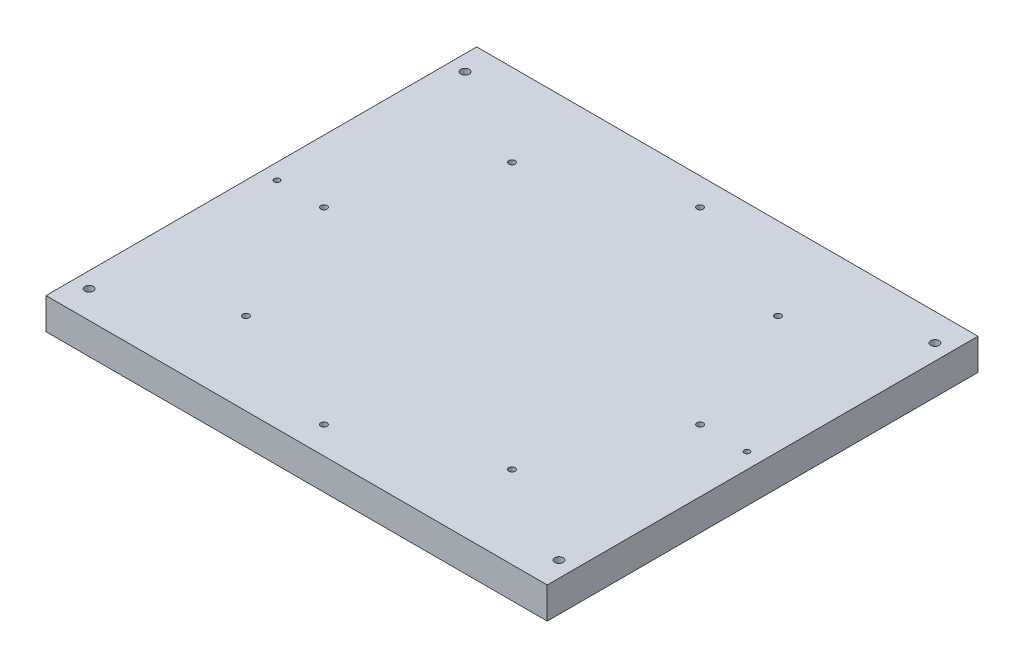
from build123d import *

# Parameters (mm, degrees)
SKETCH1_W                   = 406.4
SKETCH1_H                   = 349.25
BOSS_EXTRUDE1_DEPTH         = 25.4
F_1_4_CLEARANCE_HOLE1_D     = 6.7564
F_1_4_CLEARANCE_HOLE1_DEPTH = 70
F_1_4_CLEARANCE_HOLE1_TIP   = 2.029827343
F_8_CLEARANCE_HOLE1_D       = 4.4958
F_8_CLEARANCE_HOLE1_DEPTH   = 70
F_8_CLEARANCE_HOLE1_TIP     = 1.350674586
F_1_4_20_TAPPED_HOLE1_D     = 5.1054
F_1_4_20_TAPPED_HOLE1_DEPTH = 39.05
F_1_4_20_TAPPED_HOLE1_TIP   = 1.533816902


with BuildPart() as part:
    # Sketch1 → Boss-Extrude1 (new body)
    with BuildSketch(Plane(origin=(0, 0, 0), x_dir=(1, 0, 0), z_dir=(0, 1, 0))):
        with Locations((1.5875, 1.5875)):
            Rectangle(SKETCH1_W, SKETCH1_H)
    extrude(amount=BOSS_EXTRUDE1_DEPTH)

    # 1/4 Clearance Hole1
    with Locations(Plane(origin=(-188.9125, 25.4, -153.9875), x_dir=(0, 0, 1), z_dir=(0, 1, 0))):
        with Locations((0, 0), (0, 381), (304.8, 381), (304.8, 0)):
            Hole(F_1_4_CLEARANCE_HOLE1_D / 2, depth=F_1_4_CLEARANCE_HOLE1_DEPTH)
            with Locations((0, 0, -(F_1_4_CLEARANCE_HOLE1_DEPTH + F_1_4_CLEARANCE_HOLE1_TIP / 2))):  # 118° drill point
                Cone(0, F_1_4_CLEARANCE_HOLE1_D / 2, F_1_4_CLEARANCE_HOLE1_TIP, mode=Mode.SUBTRACT)

    # #8 Clearance Hole1
    with Locations(Plane(origin=(-188.9125, 25.4, -1.5875), x_dir=(0, 0, 1), z_dir=(0, 1, 0))):
        with Locations((0, 0), (0, 381)):
            Hole(F_8_CLEARANCE_HOLE1_D / 2, depth=F_8_CLEARANCE_HOLE1_DEPTH)
            with Locations((0, 0, -(F_8_CLEARANCE_HOLE1_DEPTH + F_8_CLEARANCE_HOLE1_TIP / 2))):  # 118° drill point
                Cone(0, F_8_CLEARANCE_HOLE1_D / 2, F_8_CLEARANCE_HOLE1_TIP, mode=Mode.SUBTRACT)

    # 1/4-20 Tapped Hole1
    with Locations(Plane(origin=(1.5875, 25.4, -154.072248936), x_dir=(0, 0, 1), z_dir=(0, 1, 0))):
        with Locations((0, 0), (44.661748936, -107.823), (44.661748936, 107.823), (152.484748936, 152.484748936), (152.484748936, -152.484748936), (260.307748936, -107.823), (304.969497872, 0), (260.307748936, 107.823)):
            Hole(F_1_4_20_TAPPED_HOLE1_D / 2, depth=F_1_4_20_TAPPED_HOLE1_DEPTH)
            with Locations((0, 0, -(F_1_4_20_TAPPED_HOLE1_DEPTH + F_1_4_20_TAPPED_HOLE1_TIP / 2))):  # 118° drill point
                Cone(0, F_1_4_20_TAPPED_HOLE1_D / 2, F_1_4_20_TAPPED_HOLE1_TIP, mode=Mode.SUBTRACT)


solid = part.part
